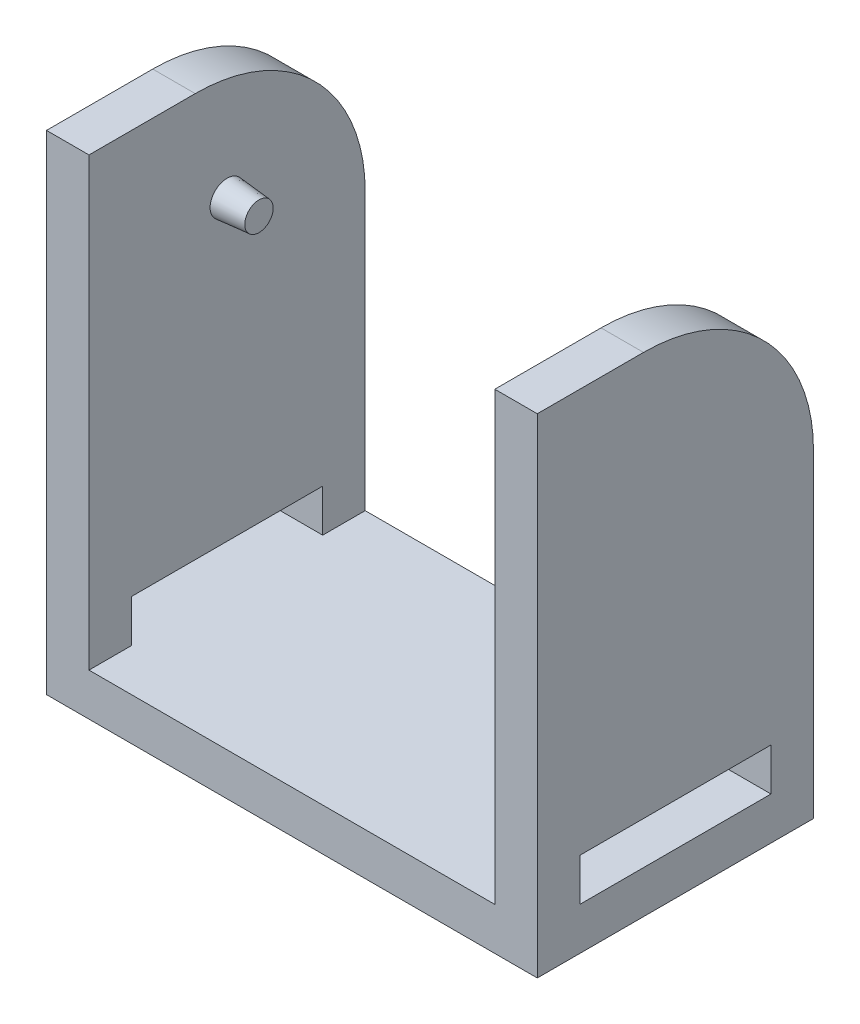
from build123d import *

# Parameters (mm, degrees)
SKETCH2_W           = 19.1
SKETCH2_H           = 13
BOSS_EXTRUDE1_DEPTH = 2
BOSS_EXTRUDE2_DEPTH = 2
SKETCH4_R           = 0.8
BOSS_EXTRUDE3_DEPTH = 1.5
BOSS_EXTRUDE3_TAPER = 5
SKETCH5_W           = 9
SKETCH5_H           = 2
CUT_EXTRUDE1_DEPTH  = 2


with BuildPart() as part:
    # Sketch2 → Boss-Extrude1 (new body)
    with BuildSketch(Plane(origin=(0, 0, 0), x_dir=(1, 0, 0), z_dir=(0, 1, 0))):
        Rectangle(SKETCH2_W, SKETCH2_H)
    extrude(amount=BOSS_EXTRUDE1_DEPTH)

    # Sketch3 → Boss-Extrude2 (add)
    with BuildSketch(Plane.ZY.offset(9.55)):
        with BuildLine():
            Line((6.5, 0), (6.5, 23))
            Line((6.5, 23), (1.5, 23))
            ThreePointArc((1.5, 23), (-4.156854249, 20.656854249), (-6.5, 15))
            Line((-6.5, 15), (-6.5, 0))
            Line((-6.5, 0), (6.5, 0))
        make_face()
    boss_extrude2 = extrude(amount=BOSS_EXTRUDE2_DEPTH)

    # Sketch4 → Boss-Extrude3 (add)
    with BuildSketch(Plane(origin=(-9.55, 0, 0), x_dir=(0, 0, -1), z_dir=(1, 0, 0))):
        with Locations((0, 18)):
            Circle(SKETCH4_R)
    boss_extrude3 = extrude(amount=BOSS_EXTRUDE3_DEPTH, taper=BOSS_EXTRUDE3_TAPER)

    # Sketch5 → Cut-Extrude1 (cut)
    with BuildSketch(Plane(origin=(-9.55, 0, 0), x_dir=(0, 0, -1), z_dir=(1, 0, 0))):
        with Locations((0, 3)):
            Rectangle(SKETCH5_W, SKETCH5_H)
    cut_extrude1 = extrude(amount=-CUT_EXTRUDE1_DEPTH, mode=Mode.SUBTRACT)

    # Mirror1: Boss-Extrude2, Boss-Extrude3, Cut-Extrude1 across plane
    add(boss_extrude2.mirror(Plane(origin=(0, 0, 0), x_dir=(0, 0, 1), z_dir=(1, 0, 0))))
    add(boss_extrude3.mirror(Plane(origin=(0, 0, 0), x_dir=(0, 0, 1), z_dir=(1, 0, 0))))
    add(cut_extrude1.mirror(Plane(origin=(0, 0, 0), x_dir=(0, 0, 1), z_dir=(1, 0, 0))), mode=Mode.SUBTRACT)


solid = part.part
